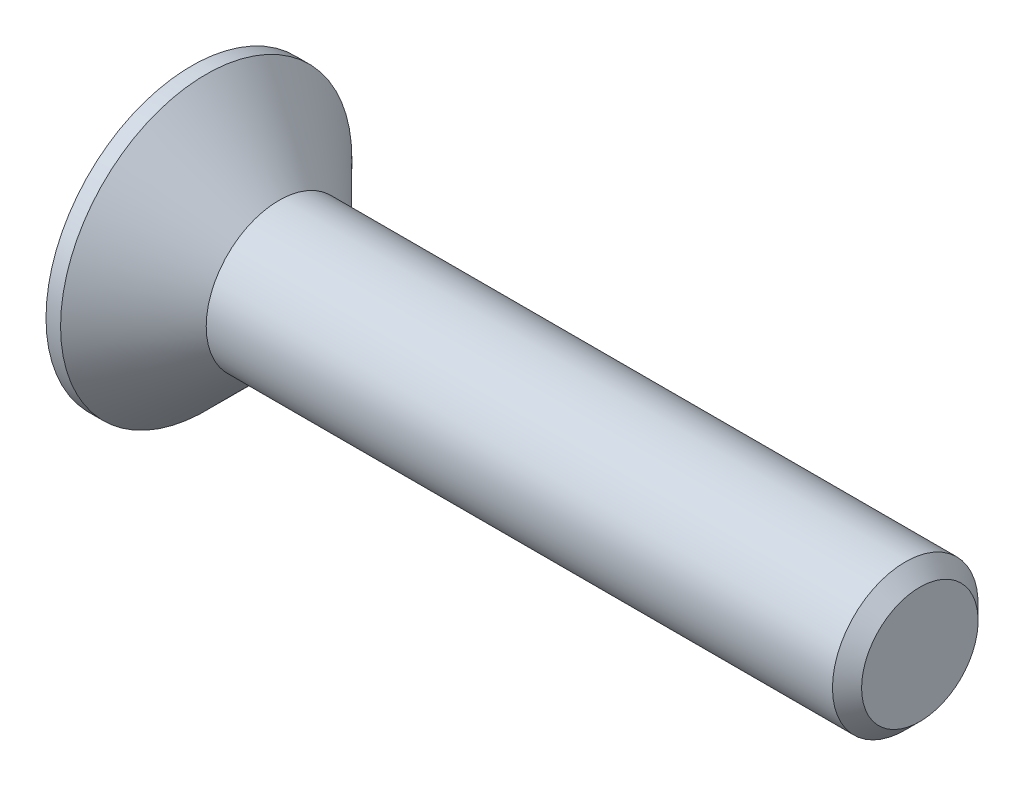
from build123d import *

# Parameters (mm, degrees)
CHAMFER1_SIZE      = 0.2
CUT_EXTRUDE1_DEPTH = 0.75


with BuildPart() as part:
    # Sketch1 → Revolve1 (revolve)
    with BuildSketch(Plane.XY, mode=Mode.PRIVATE) as revolve1_sk:
        Polygon((0, 1), (-1, 2), (-1.2, 2), (-1.2, 0), (8.8, 0), (8.8, 1), align=None)
    revolve(revolve1_sk.sketch.rotate(Axis((-1.2, 0, 0), (1, 0, 0)), 90), axis=Axis((-1.2, 0, 0), (1, 0, 0)))

    # Chamfer1
    chamfer1_edges = [part.edges().sort_by_distance(p)[0] for p in [
        (8.8, 0, -1),
    ]]
    chamfer(chamfer1_edges, length=CHAMFER1_SIZE)

    # Sketch2 → Cut-Extrude1 (cut)
    with BuildSketch(Plane.ZY.offset(1.2)):
        Polygon((-0.75055535, 0), (-0.375277675, -0.65), (0.375277675, -0.65), (0.75055535, 0), (0.375277675, 0.65), (-0.375277675, 0.65), align=None)
    extrude(amount=-CUT_EXTRUDE1_DEPTH, mode=Mode.SUBTRACT)


solid = part.part
